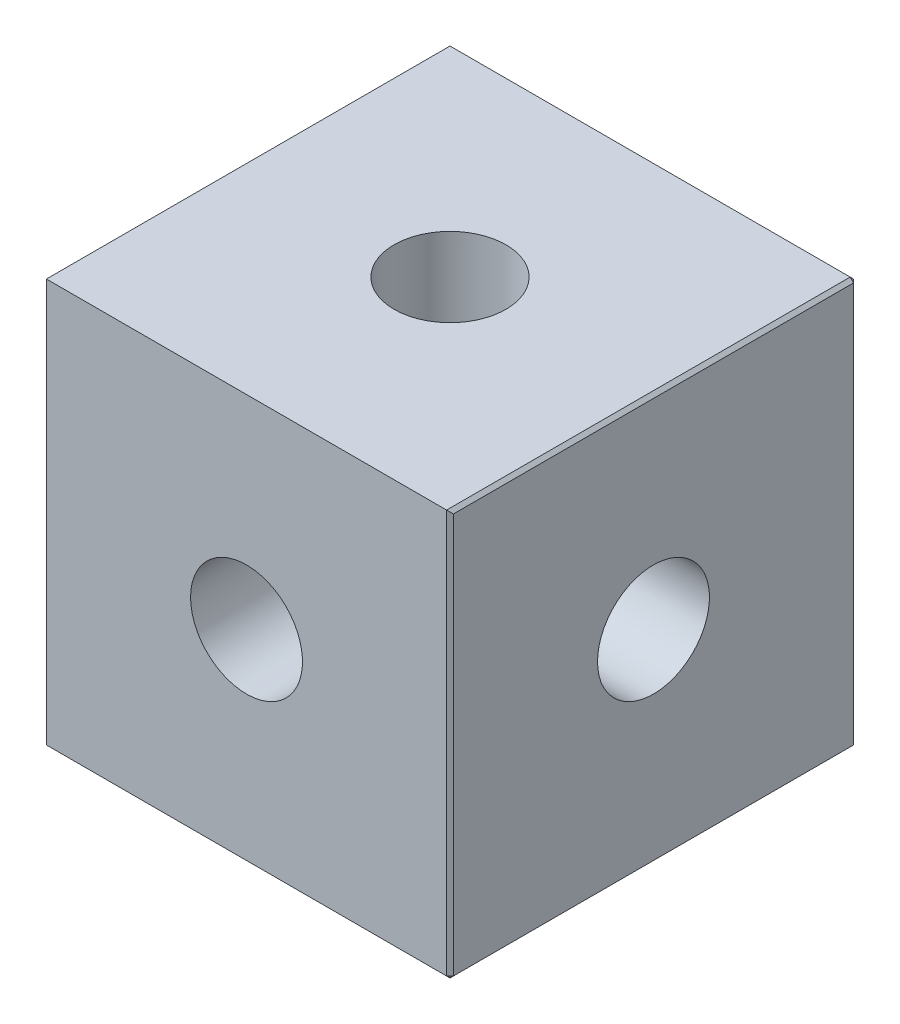
from build123d import *

# Parameters (mm, degrees)
SKETCH_1_W      = 12
SKETCH_1_H      = 12
EXTRUDE_1_DEPTH = 12
M4X0_7_1_D      = 3.3
M4X0_7_2_D      = 3.3
M4X0_7_3_D      = 3.3
CHAMFER_1_SIZE  = 0.1


with BuildPart() as part:
    # 草图1 → 凸台-拉伸1 (new body)
    with BuildSketch(Plane(origin=(0, 0, 0), x_dir=(1, 0, 0), z_dir=(0, 1, 0))):
        Rectangle(SKETCH_1_W, SKETCH_1_H)
    extrude(amount=EXTRUDE_1_DEPTH)

    # M4x0.7 螺纹孔1 (through all)
    with Locations(Plane(origin=(0, 12, 0), x_dir=(1, 0, 0), z_dir=(0, 1, 0))):
        with Locations((0, 0)):
            Hole(M4X0_7_1_D / 2)

    # M4x0.7 螺纹孔2 (through all)
    with Locations(Plane(origin=(0, 0, -6), x_dir=(-1, 0, 0), z_dir=(0, 0, -1))):
        with Locations((0, 6)):
            Hole(M4X0_7_2_D / 2)

    # M4x0.7 螺纹孔3 (through all)
    with Locations(Plane.ZY.offset(6)):
        with Locations((0, 6)):
            Hole(M4X0_7_3_D / 2)

    # 倒角1
    chamfer_1_edges = [part.edges().sort_by_distance(p)[0] for p in [
        (-6, 12, 0),
        (6, 12, 0),
        (0, 0, 6),
        (-6, 0, 0),
        (0, 0, -6),
        (6, 0, 0),
        (6, 6, 6),
        (-6, 6, 6),
        (-6, 6, -6),
        (6, 6, -6),
        (0, 12, -6),
    ]]
    chamfer(chamfer_1_edges, length=CHAMFER_1_SIZE)


solid = part.part
